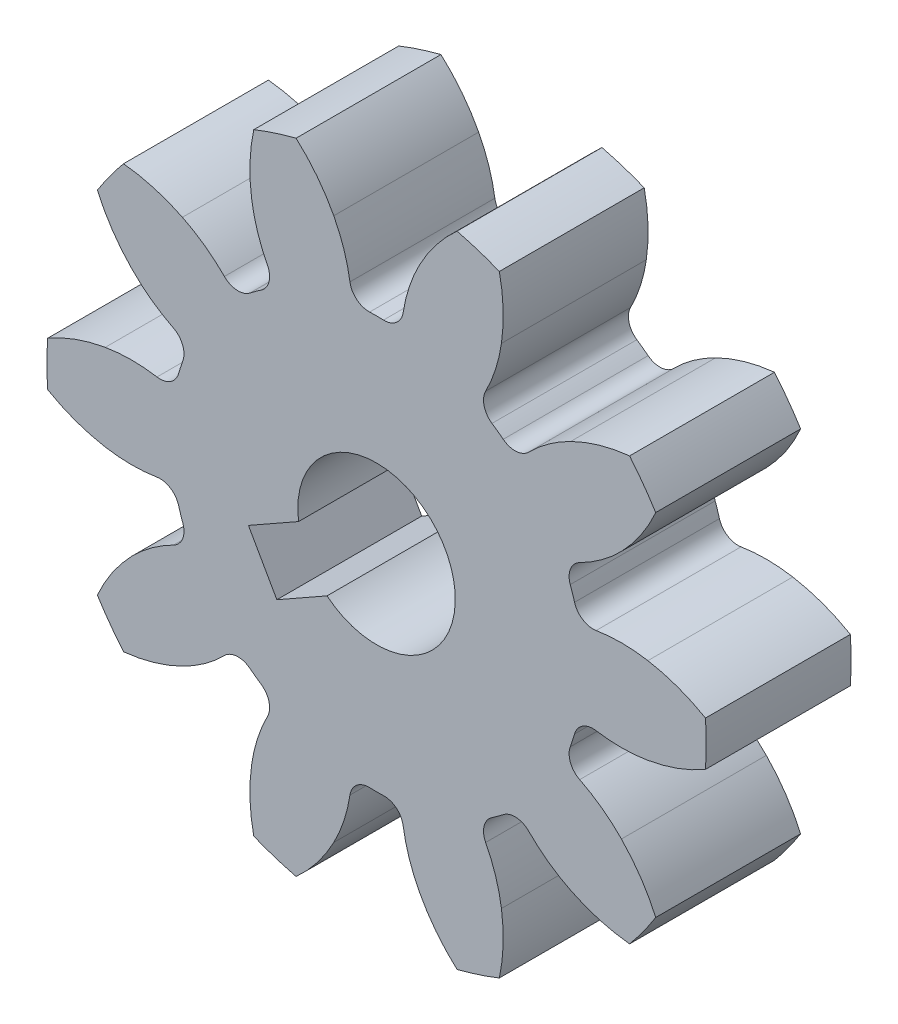
from build123d import *

# Parameters (mm, degrees)
SKETCH1_R          = 13.29266328
GEAR_BASE_DEPTH    = 2.921
GEAR_CUT_DEPTH     = 20.685496137
GEAR_TEETH_COUNT   = 10
CUT_EXTRUDE2_DEPTH = 20.416099984


with BuildPart() as part:
    # Sketch1 → GEAR_BASE (new, symmetric)
    with BuildSketch(Plane.XY):
        Circle(SKETCH1_R)
    extrude(amount=GEAR_BASE_DEPTH, both=True)

    # Sketch2 → GEAR_CUT (cut, through all)
    with BuildSketch(Plane.XY.offset(2.921)):
        with BuildLine():
            ThreePointArc((-11.256508875, -7.070071076), (-12.642074031, -4.107658854), (-13.262390488, -0.896602257))
            ThreePointArc((-13.262390488, -0.896602257), (-12.138766836, -1.422314596), (-10.939670247, -1.740231168))
            ThreePointArc((-10.939670247, -1.740231168), (-9.896826282, -1.831227702), (-8.853265833, -1.748853585))
            ThreePointArc((-8.853265833, -1.748853585), (-8.313717175, -1.858972165), (-7.983334635, -2.299524357))
            ThreePointArc((-7.983334635, -2.299524357), (-7.90129627, -2.567286784), (-7.810279896, -2.832132079))
            ThreePointArc((-7.810279896, -2.832132079), (-7.818614904, -3.382740273), (-8.19039286, -3.78896682))
            ThreePointArc((-8.19039286, -3.78896682), (-9.083069289, -4.335714202), (-9.873261359, -5.022300247))
            ThreePointArc((-9.873261359, -5.022300247), (-10.656484205, -5.984311448), (-11.256508875, -7.070071076))
        make_face()
    gear_cut = extrude(amount=-GEAR_CUT_DEPTH, mode=Mode.SUBTRACT)

    # GEAR_TEETH: GEAR_CUT ×10 about axis
    gear_teeth_axis = Axis((0, 0, 50), (0, 0, -1))
    for i in range(1, GEAR_TEETH_COUNT):
        add(gear_cut.rotate(gear_teeth_axis, i * 360 / GEAR_TEETH_COUNT), mode=Mode.SUBTRACT)

    # Sketch9 → Cut-Extrude2 (cut, through all)
    with BuildSketch(Plane(origin=(0, 0, -2.921), x_dir=(-1, 0, 0), z_dir=(0, 0, -1))):
        with BuildLine():
            Line((1.998092242, -2.467438428), (4.020440792, -3.612993749))
            Line((4.020440792, -3.612993749), (5.165996114, -1.590645198))
            Line((5.165996114, -1.590645198), (3.143647563, -0.445089877))
            ThreePointArc((3.143647563, -0.445089877), (-2.762579496, 1.564857671), (1.998092242, -2.467438428))
        make_face()
    extrude(amount=-CUT_EXTRUDE2_DEPTH, mode=Mode.SUBTRACT)


solid = part.part
